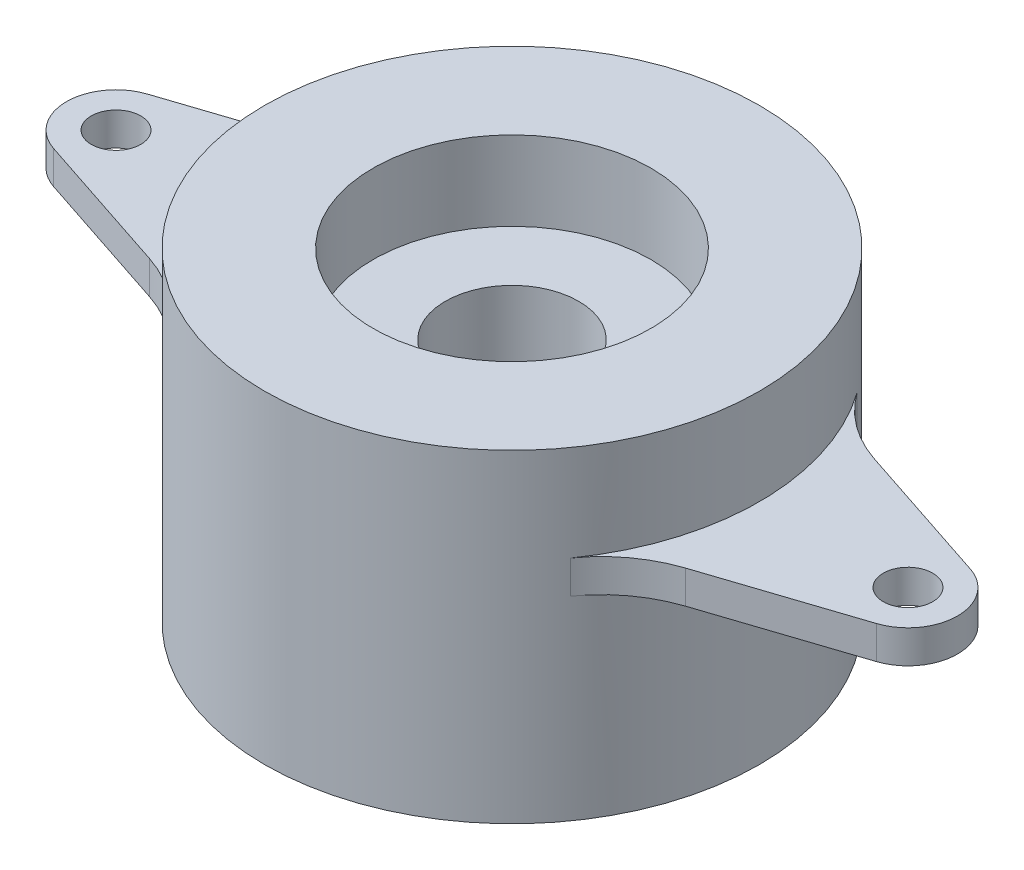
from build123d import *

# Parameters (mm, degrees)
BOSS_EXTRUDE1_START = 5
SKETCH2_R           = 3.75
BOSS_EXTRUDE1_DEPTH = 5


with BuildPart() as part:
    # Sketch1 → Revolve1 (revolve)
    with BuildSketch(Plane.XY, mode=Mode.PRIVATE) as revolve1_sk:
        Polygon((21.05, 24.5), (37.5, 24.5), (37.5, -24.5), (21.05, -24.5), (21.05, -12.5), (10.1, -12.5), (10.1, 12.5), (21.05, 12.5), align=None)
    revolve(revolve1_sk.sketch.rotate(Axis((0, 0, 0), (0, 1, 0)), 90), axis=Axis((0, 0, 0), (0, 1, 0)))

    # Sketch2 → Boss-Extrude1 (add)
    # profile 1 of 2: a face of its own
    with BuildSketch(Plane(origin=(0, 0, 0), x_dir=(1, 0, 0), z_dir=(0, 1, 0)).offset(BOSS_EXTRUDE1_START)):
        with BuildLine():
            Line((-62.354181584, 7.12094299), (-40.595729635, 14.314280578))
            ThreePointArc((-40.595729635, 14.314280578), (-34.991093182, 17.215973372), (-30.569704691, 21.719649056))
            Line((-30.569704691, 21.719649056), (-30.569704691, -21.719649056))
            ThreePointArc((-30.569704691, -21.719649056), (-34.991093182, -17.215973372), (-40.595729635, -14.314280578))
            Line((-40.595729635, -14.314280578), (-62.354181584, -7.12094299))
            ThreePointArc((-62.354181584, -7.12094299), (-67.5, 0), (-62.354181584, 7.12094299))
        make_face()
        with Locations(Location((-60, 0, 0), (0, 0, 270))):
            Circle(SKETCH2_R, mode=Mode.SUBTRACT)
    # profile 2 of 2: a face of its own
    with BuildSketch(Plane(origin=(0, 0, 0), x_dir=(1, 0, 0), z_dir=(0, 1, 0)).offset(BOSS_EXTRUDE1_START)):
        with BuildLine():
            Line((30.569704691, 21.719649056), (30.569704691, -21.719649056))
            ThreePointArc((30.569704691, -21.719649056), (34.991093182, -17.215973372), (40.595729635, -14.314280578))
            Line((40.595729635, -14.314280578), (62.354181584, -7.12094299))
            ThreePointArc((62.354181584, -7.12094299), (67.5, 0), (62.354181584, 7.12094299))
            Line((62.354181584, 7.12094299), (40.595729635, 14.314280578))
            ThreePointArc((40.595729635, 14.314280578), (34.991093182, 17.215973372), (30.569704691, 21.719649056))
        make_face()
        with Locations(Location((60, 0, 0), (0, 0, 90))):
            Circle(SKETCH2_R, mode=Mode.SUBTRACT)
    extrude(amount=BOSS_EXTRUDE1_DEPTH)


solid = part.part
